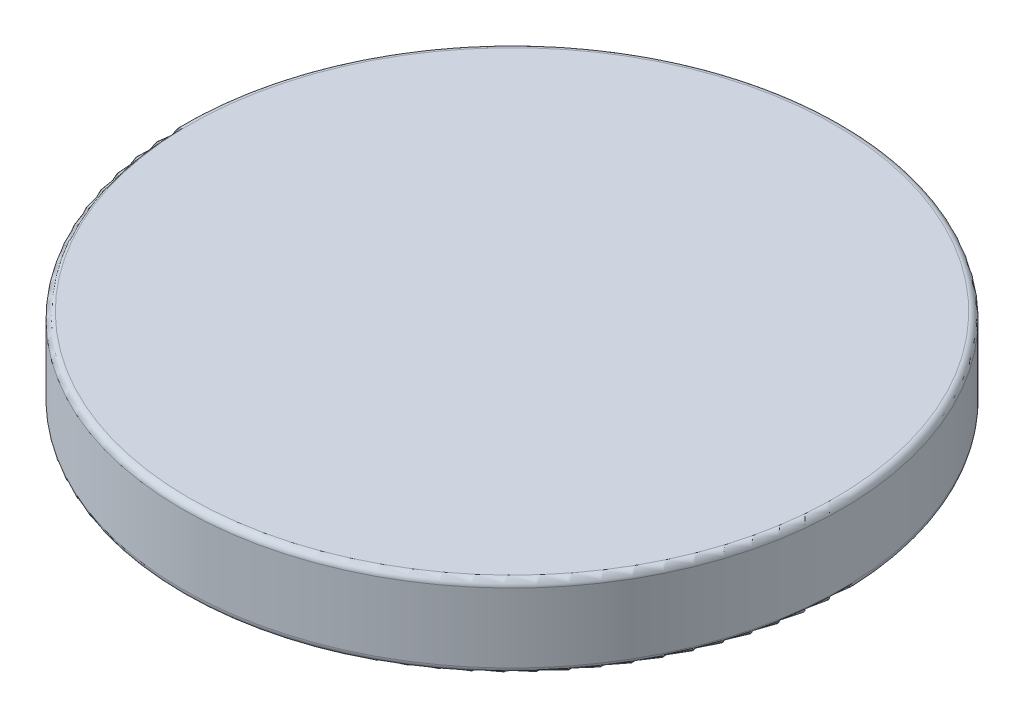
from build123d import *

# Parameters (mm, degrees)
SKETCH2_R           = 12.7
BOSS_EXTRUDE1_DEPTH = 3.175
FILLET1_R           = 0.254


with BuildPart() as part:
    # Sketch2 → Boss-Extrude1 (new body)
    with BuildSketch(Plane(origin=(0, 0, 0), x_dir=(1, 0, 0), z_dir=(0, 1, 0))):
        with Locations(Location((0, 1.660944482, 0), (0, 0, 270))):
            Circle(SKETCH2_R)
    extrude(amount=BOSS_EXTRUDE1_DEPTH)

    # Fillet1
    fillet1_edges = [part.edges().sort_by_distance(p)[0] for p in [
        (0, 0, -14.360944482),
        (0, 3.175, -14.360944482),
    ]]
    fillet(fillet1_edges, radius=FILLET1_R)


solid = part.part
